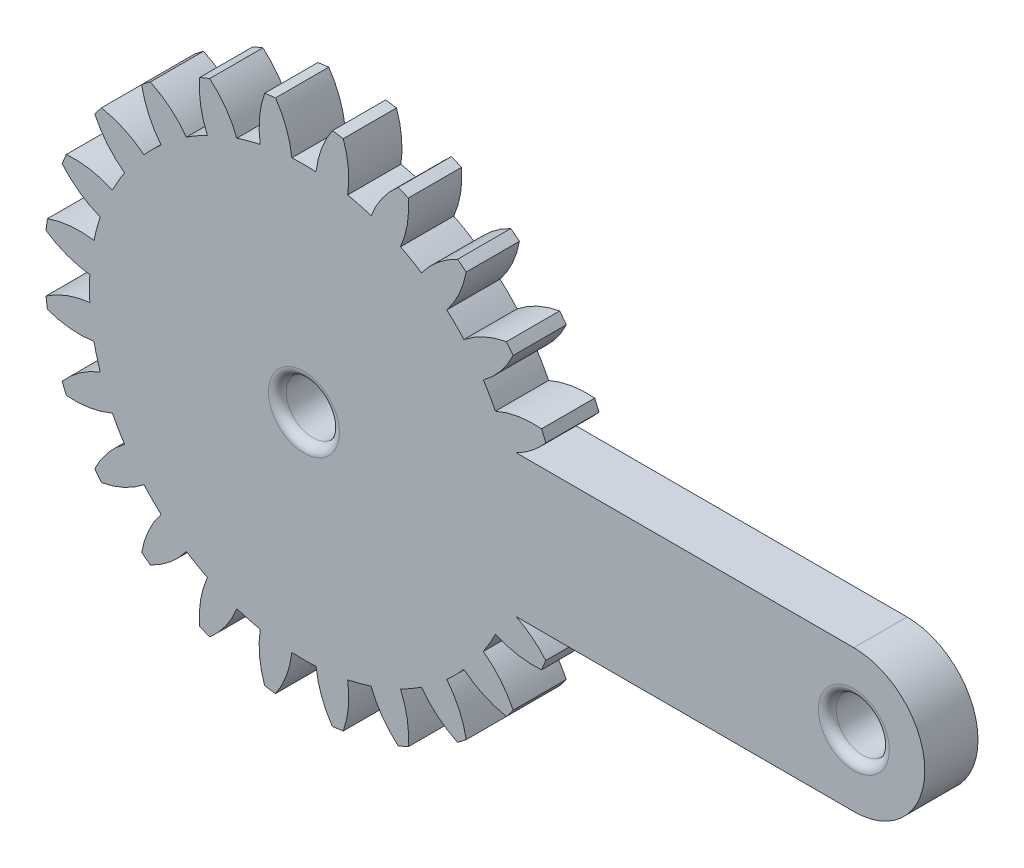
from build123d import *

# Parameters (mm, degrees)
SKETCH1_R           = 1.5
BOSS_EXTRUDE1_DEPTH = 3
FILLET1_R           = 0.5


with BuildPart() as part:
    # Sketch1 → Boss-Extrude1 (new body)
    with BuildSketch(Plane.XY):
        with BuildLine():
            ThreePointArc((31, -4), (35, 0), (31, 4))
            Line((31, 4), (11.967993881, 4))
            ThreePointArc((11.967993881, 4), (12.864888434, 4.573115684), (13.63194632, 5.311020574))
            ThreePointArc((13.63194632, 5.311020574), (13.516357561, 5.598658616), (13.394700346, 5.883783021))
            ThreePointArc((13.394700346, 5.883783021), (12.067442445, 5.825370588), (10.794615193, 5.444665539))
            ThreePointArc((10.794615193, 5.444665539), (10.470247132, 6.045), (10.112526268, 6.626078212))
            ThreePointArc((10.112526268, 6.626078212), (11.078640138, 7.538026423), (11.79285574, 8.658259265))
            ThreePointArc((11.79285574, 8.658259265), (11.606759368, 8.906179706), (11.415451897, 9.150101529))
            ThreePointArc((11.415451897, 9.150101529), (10.148537462, 8.750159829), (9.017614465, 8.052995056))
            ThreePointArc((9.017614465, 8.052995056), (8.548920985, 8.548920985), (8.052995056, 9.017614465))
            ThreePointArc((8.052995056, 9.017614465), (8.750159829, 10.148537462), (9.150101529, 11.415451897))
            ThreePointArc((9.150101529, 11.415451897), (8.906179706, 11.606759368), (8.658259265, 11.79285574))
            ThreePointArc((8.658259265, 11.79285574), (7.538026423, 11.078640138), (6.626078212, 10.112526268))
            ThreePointArc((6.626078212, 10.112526268), (6.045, 10.470247132), (5.444665539, 10.794615193))
            ThreePointArc((5.444665539, 10.794615193), (5.825370588, 12.067442445), (5.883783021, 13.394700346))
            ThreePointArc((5.883783021, 13.394700346), (5.598658616, 13.516357561), (5.311020574, 13.63194632))
            ThreePointArc((5.311020574, 13.63194632), (4.413811339, 12.65212943), (3.78298568, 11.482905527))
            ThreePointArc((3.78298568, 11.482905527), (3.129122255, 11.67804324), (2.465291063, 11.835980736))
            ThreePointArc((2.465291063, 11.835980736), (2.503591968, 13.163971168), (2.216494423, 14.461122103))
            ThreePointArc((2.216494423, 14.461122103), (1.909598192, 14.504838322), (1.601844607, 14.542042286))
            ThreePointArc((1.601844607, 14.542042286), (0.988802307, 13.36339701), (0.682088925, 12.070743751))
            ThreePointArc((0.682088925, 12.070743751), (0, 12.09), (-0.682088925, 12.070743751))
            ThreePointArc((-0.682088925, 12.070743751), (-0.988802307, 13.36339701), (-1.601844607, 14.542042286))
            ThreePointArc((-1.601844607, 14.542042286), (-1.909598192, 14.504838322), (-2.216494423, 14.461122103))
            ThreePointArc((-2.216494423, 14.461122103), (-2.503591968, 13.163971168), (-2.465291063, 11.835980736))
            ThreePointArc((-2.465291063, 11.835980736), (-3.129122255, 11.67804324), (-3.78298568, 11.482905527))
            ThreePointArc((-3.78298568, 11.482905527), (-4.413811339, 12.65212943), (-5.311020574, 13.63194632))
            ThreePointArc((-5.311020574, 13.63194632), (-5.598658616, 13.516357561), (-5.883783021, 13.394700346))
            ThreePointArc((-5.883783021, 13.394700346), (-5.825370588, 12.067442445), (-5.444665539, 10.794615193))
            ThreePointArc((-5.444665539, 10.794615193), (-6.045, 10.470247132), (-6.626078212, 10.112526268))
            ThreePointArc((-6.626078212, 10.112526268), (-7.538026423, 11.078640138), (-8.658259265, 11.79285574))
            ThreePointArc((-8.658259265, 11.79285574), (-8.906179706, 11.606759368), (-9.150101529, 11.415451897))
            ThreePointArc((-9.150101529, 11.415451897), (-8.750159829, 10.148537462), (-8.052995056, 9.017614465))
            ThreePointArc((-8.052995056, 9.017614465), (-8.548920985, 8.548920985), (-9.017614465, 8.052995056))
            ThreePointArc((-9.017614465, 8.052995056), (-10.148537462, 8.750159829), (-11.415451897, 9.150101529))
            ThreePointArc((-11.415451897, 9.150101529), (-11.606759368, 8.906179706), (-11.79285574, 8.658259265))
            ThreePointArc((-11.79285574, 8.658259265), (-11.078640138, 7.538026423), (-10.112526268, 6.626078212))
            ThreePointArc((-10.112526268, 6.626078212), (-10.470247132, 6.045), (-10.794615193, 5.444665539))
            ThreePointArc((-10.794615193, 5.444665539), (-12.067442445, 5.825370588), (-13.394700346, 5.883783021))
            ThreePointArc((-13.394700346, 5.883783021), (-13.516357561, 5.598658616), (-13.63194632, 5.311020574))
            ThreePointArc((-13.63194632, 5.311020574), (-12.65212943, 4.413811339), (-11.482905527, 3.78298568))
            ThreePointArc((-11.482905527, 3.78298568), (-11.67804324, 3.129122255), (-11.835980736, 2.465291063))
            ThreePointArc((-11.835980736, 2.465291063), (-13.163971168, 2.503591968), (-14.461122103, 2.216494423))
            ThreePointArc((-14.461122103, 2.216494423), (-14.504838322, 1.909598192), (-14.542042286, 1.601844607))
            ThreePointArc((-14.542042286, 1.601844607), (-13.36339701, 0.988802307), (-12.070743751, 0.682088925))
            ThreePointArc((-12.070743751, 0.682088925), (-12.09, 0), (-12.070743751, -0.682088925))
            ThreePointArc((-12.070743751, -0.682088925), (-13.36339701, -0.988802307), (-14.542042286, -1.601844607))
            ThreePointArc((-14.542042286, -1.601844607), (-14.504838322, -1.909598192), (-14.461122103, -2.216494423))
            ThreePointArc((-14.461122103, -2.216494423), (-13.163971168, -2.503591968), (-11.835980736, -2.465291063))
            ThreePointArc((-11.835980736, -2.465291063), (-11.67804324, -3.129122255), (-11.482905527, -3.78298568))
            ThreePointArc((-11.482905527, -3.78298568), (-12.65212943, -4.413811339), (-13.63194632, -5.311020574))
            ThreePointArc((-13.63194632, -5.311020574), (-13.516357561, -5.598658616), (-13.394700346, -5.883783021))
            ThreePointArc((-13.394700346, -5.883783021), (-12.067442445, -5.825370588), (-10.794615193, -5.444665539))
            ThreePointArc((-10.794615193, -5.444665539), (-10.470247132, -6.045), (-10.112526268, -6.626078212))
            ThreePointArc((-10.112526268, -6.626078212), (-11.078640138, -7.538026423), (-11.79285574, -8.658259265))
            ThreePointArc((-11.79285574, -8.658259265), (-11.606759368, -8.906179706), (-11.415451897, -9.150101529))
            ThreePointArc((-11.415451897, -9.150101529), (-10.148537462, -8.750159829), (-9.017614465, -8.052995056))
            ThreePointArc((-9.017614465, -8.052995056), (-8.548920985, -8.548920985), (-8.052995056, -9.017614465))
            ThreePointArc((-8.052995056, -9.017614465), (-8.750159829, -10.148537462), (-9.150101529, -11.415451897))
            ThreePointArc((-9.150101529, -11.415451897), (-8.906179706, -11.606759368), (-8.658259265, -11.79285574))
            ThreePointArc((-8.658259265, -11.79285574), (-7.538026423, -11.078640138), (-6.626078212, -10.112526268))
            ThreePointArc((-6.626078212, -10.112526268), (-6.045, -10.470247132), (-5.444665539, -10.794615193))
            ThreePointArc((-5.444665539, -10.794615193), (-5.825370588, -12.067442445), (-5.883783021, -13.394700346))
            ThreePointArc((-5.883783021, -13.394700346), (-5.598658616, -13.516357561), (-5.311020574, -13.63194632))
            ThreePointArc((-5.311020574, -13.63194632), (-4.413811339, -12.65212943), (-3.78298568, -11.482905527))
            ThreePointArc((-3.78298568, -11.482905527), (-3.129122255, -11.67804324), (-2.465291063, -11.835980736))
            ThreePointArc((-2.465291063, -11.835980736), (-2.503591968, -13.163971168), (-2.216494423, -14.461122103))
            ThreePointArc((-2.216494423, -14.461122103), (-1.909598192, -14.504838322), (-1.601844607, -14.542042286))
            ThreePointArc((-1.601844607, -14.542042286), (-0.988802307, -13.36339701), (-0.682088925, -12.070743751))
            ThreePointArc((-0.682088925, -12.070743751), (0, -12.09), (0.682088925, -12.070743751))
            ThreePointArc((0.682088925, -12.070743751), (0.988802307, -13.36339701), (1.601844607, -14.542042286))
            ThreePointArc((1.601844607, -14.542042286), (1.909598192, -14.504838322), (2.216494423, -14.461122103))
            ThreePointArc((2.216494423, -14.461122103), (2.503591968, -13.163971168), (2.465291063, -11.835980736))
            ThreePointArc((2.465291063, -11.835980736), (3.129122255, -11.67804324), (3.78298568, -11.482905527))
            ThreePointArc((3.78298568, -11.482905527), (4.413811339, -12.65212943), (5.311020574, -13.63194632))
            ThreePointArc((5.311020574, -13.63194632), (5.598658616, -13.516357561), (5.883783021, -13.394700346))
            ThreePointArc((5.883783021, -13.394700346), (5.825370588, -12.067442445), (5.444665539, -10.794615193))
            ThreePointArc((5.444665539, -10.794615193), (6.045, -10.470247132), (6.626078212, -10.112526268))
            ThreePointArc((6.626078212, -10.112526268), (7.538026423, -11.078640138), (8.658259265, -11.79285574))
            ThreePointArc((8.658259265, -11.79285574), (8.906179706, -11.606759368), (9.150101529, -11.415451897))
            ThreePointArc((9.150101529, -11.415451897), (8.750159829, -10.148537462), (8.052995056, -9.017614465))
            ThreePointArc((8.052995056, -9.017614465), (8.548920985, -8.548920985), (9.017614465, -8.052995056))
            ThreePointArc((9.017614465, -8.052995056), (10.148537462, -8.750159829), (11.415451897, -9.150101529))
            ThreePointArc((11.415451897, -9.150101529), (11.606759368, -8.906179706), (11.79285574, -8.658259265))
            ThreePointArc((11.79285574, -8.658259265), (11.078640138, -7.538026423), (10.112526268, -6.626078212))
            ThreePointArc((10.112526268, -6.626078212), (10.470247132, -6.045), (10.794615193, -5.444665539))
            ThreePointArc((10.794615193, -5.444665539), (12.067442445, -5.825370588), (13.394700346, -5.883783021))
            ThreePointArc((13.394700346, -5.883783021), (13.516357561, -5.598658616), (13.63194632, -5.311020574))
            ThreePointArc((13.63194632, -5.311020574), (12.864888434, -4.573115684), (11.967993881, -4))
            Line((11.967993881, -4), (31, -4))
        make_face()
        Circle(SKETCH1_R, mode=Mode.SUBTRACT)
        with Locations((31, 0)):
            Circle(SKETCH1_R, mode=Mode.SUBTRACT)
    extrude(amount=-BOSS_EXTRUDE1_DEPTH)

    # Fillet1
    fillet1_edges = [part.edges().sort_by_distance(p)[0] for p in [
        (-1.5, 0, -3),
        (-1.5, 0, 0),
        (29.5, 0, 0),
        (29.5, 0, -3),
    ]]
    fillet(fillet1_edges, radius=FILLET1_R)


solid = part.part
